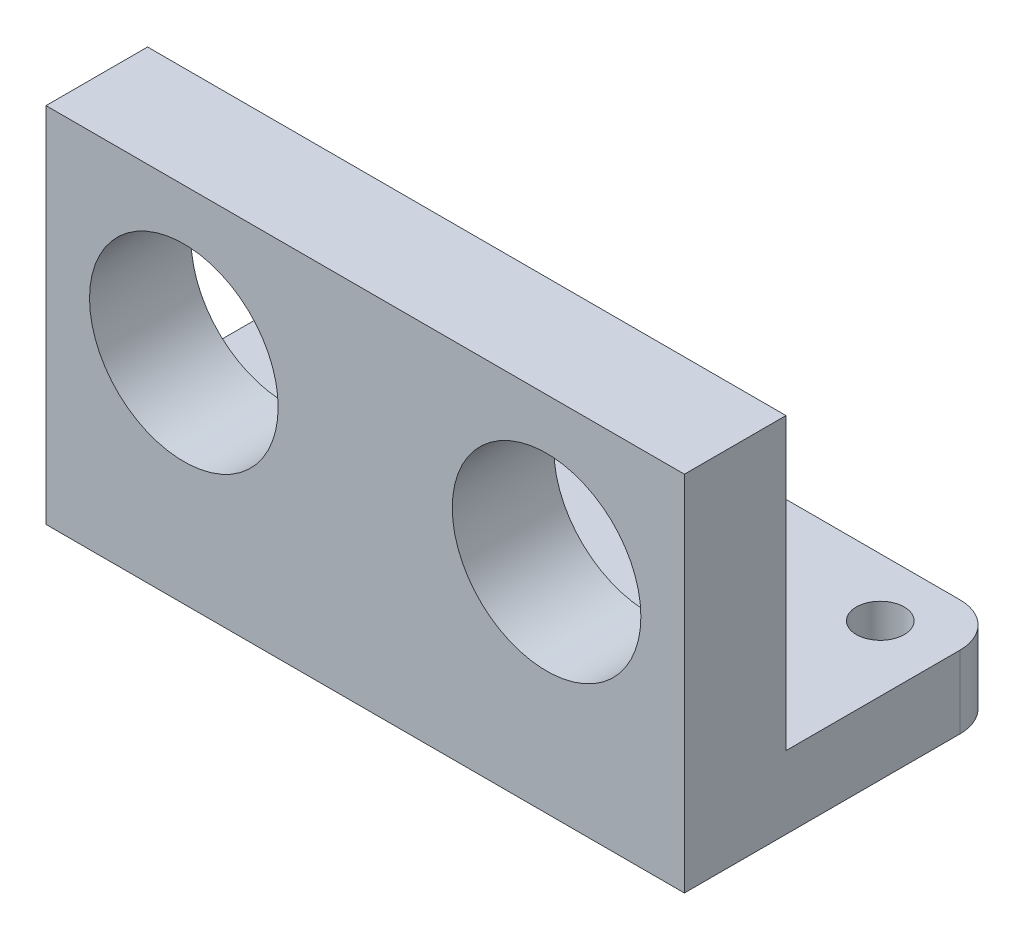
from build123d import *

# Parameters (mm, degrees)
SKETCH1_R           = 6.5
BOSS_EXTRUDE1_DEPTH = 7
SKETCH2_W           = 22
SKETCH2_H           = 5
BOSS_EXTRUDE2_DEPTH = 15
SKETCH3_R           = 1.651
CUT_EXTRUDE1_DEPTH  = 34.301651611
FILLET1_R           = 3


with BuildPart() as part:
    # Sketch1 → Boss-Extrude1 (new body)
    with BuildSketch(Plane.XY):
        Polygon((22, 10), (-22, 10), (-22, -10), (-22, -15), (22, -15), (22, -10), align=None)
        with Locations((-12.5, 0)):
            Circle(SKETCH1_R, mode=Mode.SUBTRACT)
        with Locations((12.5, 0)):
            Circle(SKETCH1_R, mode=Mode.SUBTRACT)
    extrude(amount=BOSS_EXTRUDE1_DEPTH)

    # Sketch2 → Boss-Extrude2 (add)
    with BuildSketch(Plane(origin=(0, 0, 0), x_dir=(-1, 0, 0), z_dir=(0, 0, -1))):
        with Locations((-11, -12.5)):
            Rectangle(SKETCH2_W, SKETCH2_H)
        with Locations((11, -12.5)):
            Rectangle(SKETCH2_W, SKETCH2_H)
    extrude(amount=BOSS_EXTRUDE2_DEPTH)

    # Sketch3 → Cut-Extrude1 (cut, through all)
    with BuildSketch(Plane(origin=(0, -10, 0), x_dir=(1, 0, 0), z_dir=(0, 1, 0))):
        with Locations(Location((17.5, 11, 0), (0, 0, 270))):
            Circle(SKETCH3_R)
        with Locations(Location((0, 11, 0), (0, 0, 270))):
            Circle(SKETCH3_R)
        with Locations(Location((-17.5, 11, 0), (0, 0, 270))):
            Circle(SKETCH3_R)
    extrude(amount=-CUT_EXTRUDE1_DEPTH, mode=Mode.SUBTRACT)

    # Fillet1
    fillet1_edges = [part.edges().sort_by_distance(p)[0] for p in [
        (-22, -12.5, -15),
        (22, -12.5, -15),
    ]]
    fillet(fillet1_edges, radius=FILLET1_R)


solid = part.part
